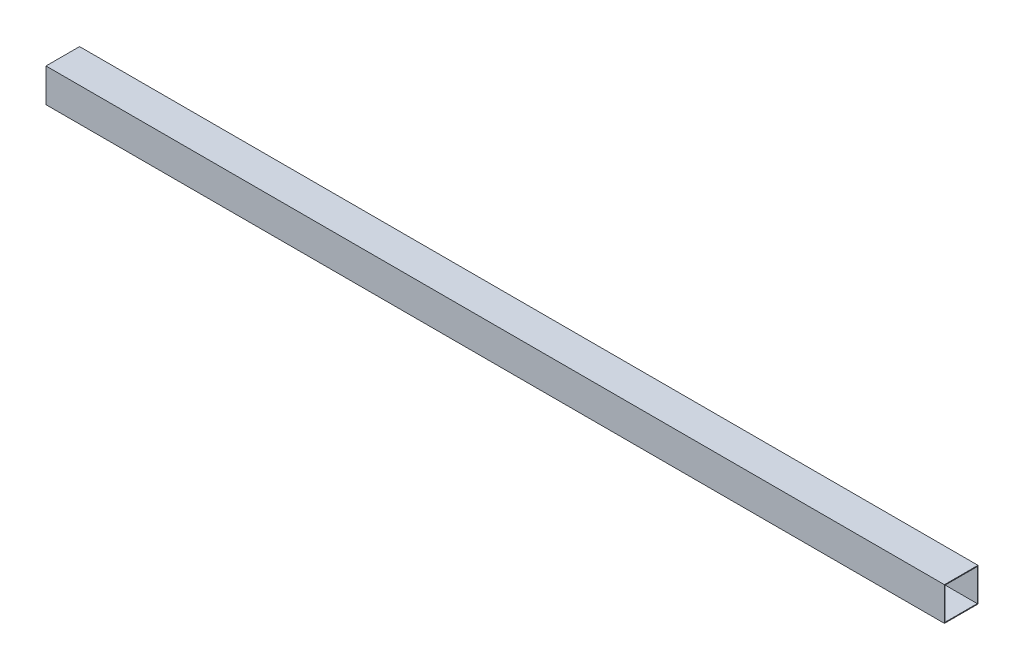
from build123d import *

# Parameters (mm, degrees)
SKETCH13_W                             = 25.4
SKETCH13_H                             = 25.4
SKETCH13_W_2                           = 24.2824
SKETCH13_H_2                           = 24.2824
AL_TUBE_SQUARE_1_SQ_X_022_WALL_1_DEPTH = 680


with BuildPart() as part:
    # Sketch13 → Al tube (square) 1 SQ X .022 WALL(1) (new body)
    with BuildSketch(Plane(origin=(680, 0, 0), x_dir=(0, -1, 0), z_dir=(-1, 0, 0))):
        Rectangle(SKETCH13_W, SKETCH13_H)
        Rectangle(SKETCH13_W_2, SKETCH13_H_2, mode=Mode.SUBTRACT)
    extrude(amount=AL_TUBE_SQUARE_1_SQ_X_022_WALL_1_DEPTH)


solid = part.part
